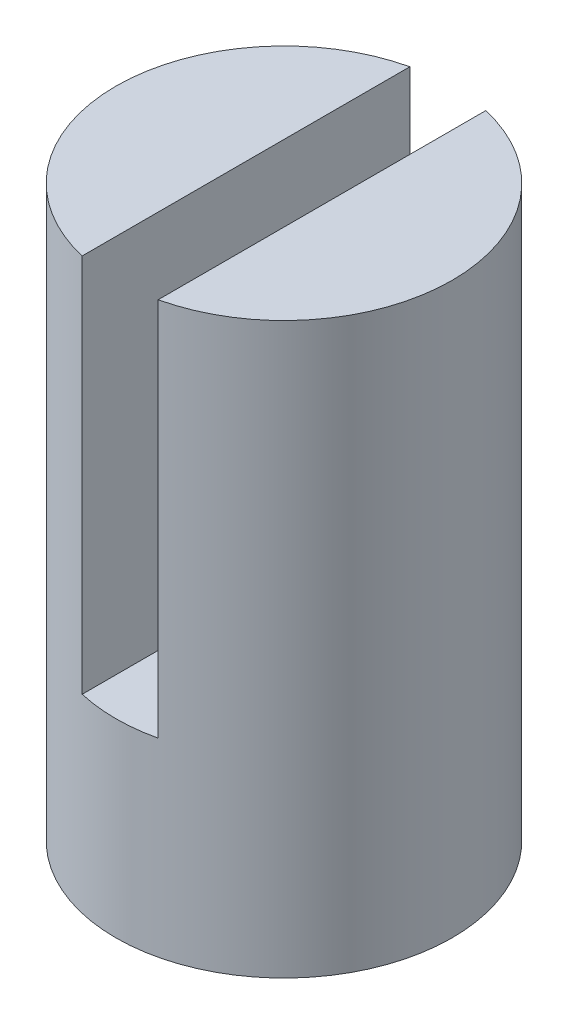
from build123d import *

# Parameters (mm, degrees)
BOSS_EXTRUDE1_DEPTH = 6.35
BOSS_EXTRUDE2_START = 6.35
BOSS_EXTRUDE2_DEPTH = 12.7


with BuildPart() as part:
    # Sketch1 → Boss-Extrude1 (new body)
    with BuildSketch(Plane(origin=(0, 0, 0), x_dir=(1, 0, 0), z_dir=(0, 1, 0))):
        with BuildLine():
            ThreePointArc((-1.27, 5.480885075), (-5.6261, 0), (-1.27, -5.480885075))
            Line((-1.27, -5.480885075), (-1.27, 5.480885075))
        make_face()
        with BuildLine():
            ThreePointArc((-1.27, -5.480885075), (-0.639137568, -5.589678379), (2.1e-08, -5.6261))
            ThreePointArc((2.1e-08, -5.6261), (0.639137588, -5.589678377), (1.27, -5.480885075))
            Line((1.27, -5.480885075), (1.27, 5.480885075))
            ThreePointArc((1.27, 5.480885075), (0.639137578, 5.589678378), (0, 5.6261))
            ThreePointArc((0, 5.6261), (-0.639137578, 5.589678378), (-1.27, 5.480885075))
            Line((-1.27, 5.480885075), (-1.27, -5.480885075))
        make_face()
        with BuildLine():
            Line((1.27, 5.480885075), (1.27, -5.480885075))
            ThreePointArc((1.27, -5.480885075), (4.404438001, -3.50056097), (5.6261, 0))
            ThreePointArc((5.6261, 0), (4.404438001, 3.50056097), (1.27, 5.480885075))
        make_face()
    extrude(amount=BOSS_EXTRUDE1_DEPTH)

    # Sketch1<3> → Boss-Extrude2 (add)
    with BuildSketch(Plane(origin=(0, 0, 0), x_dir=(1, 0, 0), z_dir=(0, 1, 0)).offset(BOSS_EXTRUDE2_START)):
        with BuildLine():
            ThreePointArc((-1.27, 5.480885075), (-5.6261, 0), (-1.27, -5.480885075))
            Line((-1.27, -5.480885075), (-1.27, 5.480885075))
        make_face()
        with BuildLine():
            Line((1.27, 5.480885075), (1.27, -5.480885075))
            ThreePointArc((1.27, -5.480885075), (4.404438001, -3.50056097), (5.6261, 0))
            ThreePointArc((5.6261, 0), (4.404438001, 3.50056097), (1.27, 5.480885075))
        make_face()
    extrude(amount=BOSS_EXTRUDE2_DEPTH)


solid = part.part
